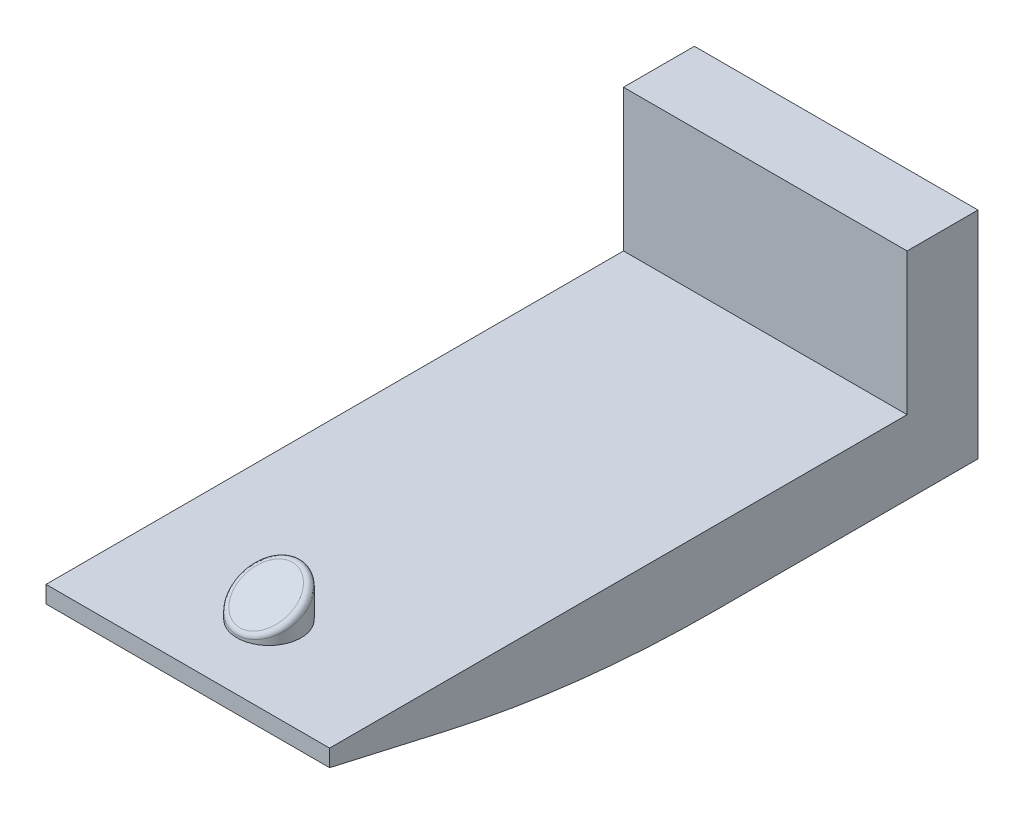
from build123d import *

# Parameters (mm, degrees)
BOSS_EXTRUDE1_DEPTH = 12.7
SKETCH2_R           = 1.4351
BOSS_EXTRUDE2_DEPTH = 3.81
CUT_EXTRUDE1_DEPTH  = 34.12884745
FILLET1_R           = 0.254


with BuildPart() as part:
    # Sketch1 → Boss-Extrude1 (new body)
    with BuildSketch(Plane(origin=(0, 0, 0), x_dir=(0, 0, -1), z_dir=(1, 0, 0))):
        with BuildLine():
            ThreePointArc((-23.9, 1.3716), (-17.832549445, 0.343974693), (-11.688312193, 0))
            Line((-11.688312193, 0), (0, 0))
            Line((0, 0), (0, 9.652))
            Line((0, 9.652), (-3.175, 9.652))
            Line((-3.175, 9.652), (-3.175, 3.302))
            Line((-3.175, 3.302), (-29.035657895, 3.302))
            Line((-29.035657895, 3.302), (-29.035657895, 2.54))
            Line((-29.035657895, 2.54), (-23.9, 1.3716))
        make_face()
    extrude(amount=BOSS_EXTRUDE1_DEPTH)

    # Sketch2 → Boss-Extrude2 (add)
    with BuildSketch(Plane(origin=(0, 3.302, 0), x_dir=(1, 0, 0), z_dir=(0, 1, 0))):
        with Locations(Location((6.35, -25.4, 0), (0, 0, 90))):
            Circle(SKETCH2_R)
    extrude(amount=BOSS_EXTRUDE2_DEPTH)

    # Sketch3 → Cut-Extrude1 (cut, through all)
    with BuildSketch(Plane(origin=(12.7, 0, 0), x_dir=(0, 0, -1), z_dir=(1, 0, 0))):
        Polygon((-26.8351, 3.556), (-23.9649, 5.207), (-23.9649, 7.112), (-26.8351, 7.112), align=None)
    extrude(amount=-CUT_EXTRUDE1_DEPTH, mode=Mode.SUBTRACT)

    # Fillet1
    fillet1_edges = [part.edges().sort_by_distance(p)[0] for p in [
        (7.7851, 4.3815, 25.4),
    ]]
    fillet(fillet1_edges, radius=FILLET1_R)


solid = part.part
